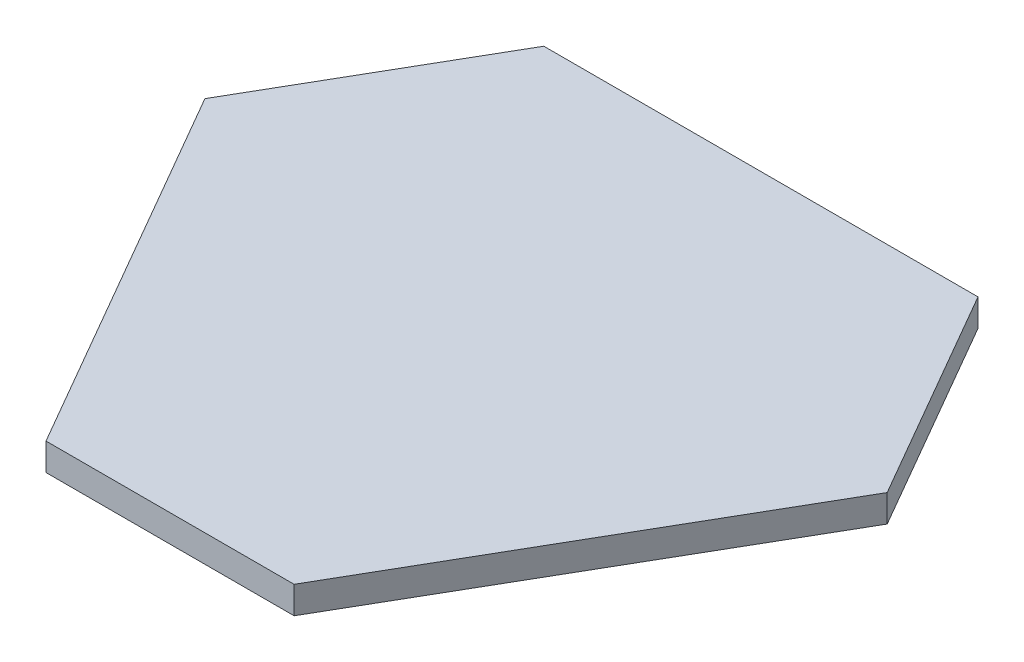
from build123d import *

# Parameters (mm, degrees)
BOSS_EXTRUDE1_DEPTH = 6.35


with BuildPart() as part:
    # Sketch1 → Boss-Extrude1 (new body)
    with BuildSketch(Plane(origin=(0, 0, 0), x_dir=(1, 0, 0), z_dir=(0, 1, 0))):
        Polygon((50.518148554, 62.5), (-50.518148554, 62.5), (-79.385662014, 12.5), (-28.867513459, -75), (28.867513459, -75), (79.385662014, 12.5), align=None)
    extrude(amount=BOSS_EXTRUDE1_DEPTH)


solid = part.part
